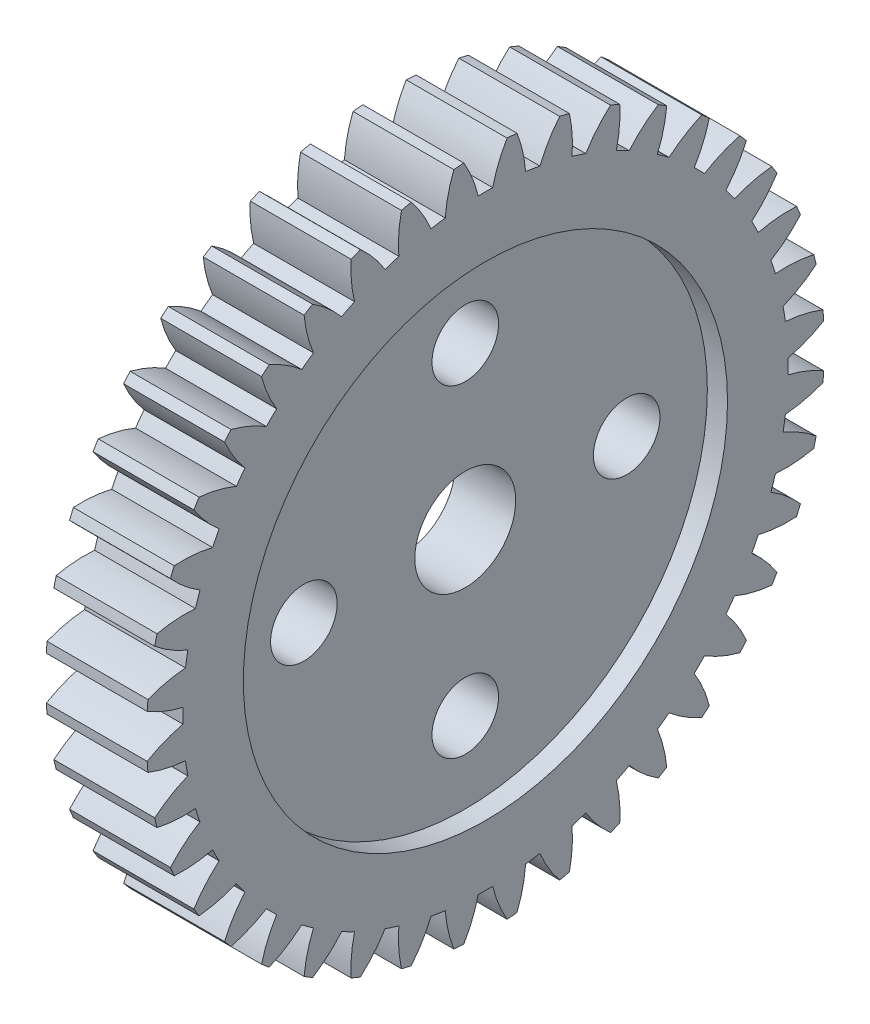
from build123d import *

# Parameters (mm, degrees)
BASPROSKE_W         = 5
BASPROSKE_H         = 16.8
TOOTHCUT_DEPTH      = 25.279209213
TEETHCUTS_COUNT     = 40
TEETHCUTS_ANGLE     = 351
BORSKE_R            = 2.5
BORE_DEPTH          = 50.0000508
SKETCH_1_R          = 1.65
CUT_EXTRUDE_1_DEPTH = 10
SKETCH_2_R          = 12
CUT_EXTRUDE_2_DEPTH = 1
CUT_EXTRUDE_START   = -1
SKETCH_3_R          = 12
CUT_EXTRUDE_3_DEPTH = 1


with BuildPart() as part:
    # BasProSke → Base-Revolve (revolve)
    with BuildSketch(Plane(origin=(0, 0, 0), x_dir=(1, 0, 0), z_dir=(0, 1, 0)), mode=Mode.PRIVATE) as base_revolve_sk:
        with Locations((2.5, 8.4)):
            Rectangle(BASPROSKE_W, BASPROSKE_H)
    revolve(base_revolve_sk.sketch.rotate(Axis((-10, 0, 0), (1, 0, 0)), 180), axis=Axis((-10, 0, 0), (1, 0, 0)))

    # TooCutSke → ToothCut (cut, through all)
    with BuildSketch(Plane(origin=(0, 0, 0), x_dir=(0, 0, -1), z_dir=(1, 0, 0))):
        with BuildLine():
            ThreePointArc((0.358234928, 14.994721362), (0, 14.999), (-0.358234928, 14.994721362))
            ThreePointArc((-0.358234928, 14.994721362), (-0.653764873, 15.920217236), (-1.085976921, 16.790316831))
            ThreePointArc((-1.085976921, 16.790316831), (0, 16.8254), (1.085976921, 16.790316831))
            ThreePointArc((1.085976921, 16.790316831), (0.653764873, 15.920217236), (0.358234928, 14.994721362))
        make_face()
    toothcut = extrude(amount=TOOTHCUT_DEPTH, mode=Mode.SUBTRACT)

    # TeethCuts: ToothCut ×40 about axis
    teethcuts_axis = Axis((-10, 0, 0), (1, 0, 0))
    for i in range(1, TEETHCUTS_COUNT):
        add(toothcut.rotate(teethcuts_axis, i * TEETHCUTS_ANGLE / (TEETHCUTS_COUNT - 1)), mode=Mode.SUBTRACT)

    # BorSke → Bore (cut, symmetric)
    with BuildSketch(Plane(origin=(0, 0, 0), x_dir=(0, 0, -1), z_dir=(1, 0, 0))):
        with Locations(Location((0, 0, 0), (0, 0, 180))):
            Circle(BORSKE_R)
    extrude(amount=BORE_DEPTH, both=True, mode=Mode.SUBTRACT)

    # 草图1 → 切除-拉伸1 (cut)
    with BuildSketch(Plane(origin=(5, 0, 0), x_dir=(0, 0, -1), z_dir=(1, 0, 0))):
        with Locations((8, 0)):
            Circle(SKETCH_1_R)
        with Locations((0, -8)):
            Circle(SKETCH_1_R)
        with Locations((-8, 0)):
            Circle(SKETCH_1_R)
        with Locations((0, 8)):
            Circle(SKETCH_1_R)
    extrude(amount=-CUT_EXTRUDE_1_DEPTH, mode=Mode.SUBTRACT)

    # 草图2 → 切除-拉伸2 (cut)
    with BuildSketch(Plane.ZY):
        Circle(SKETCH_2_R)
    extrude(amount=-CUT_EXTRUDE_2_DEPTH, mode=Mode.SUBTRACT)

    # 草图3 → 切除-拉伸3 (cut)
    with BuildSketch(Plane(origin=(5, 0, 0), x_dir=(0, 0, -1), z_dir=(1, 0, 0)).offset(CUT_EXTRUDE_START)):
        with Locations(Location((0, 0, 0), (0, 0, 180))):
            Circle(SKETCH_3_R)
    extrude(amount=CUT_EXTRUDE_3_DEPTH, mode=Mode.SUBTRACT)


solid = part.part
